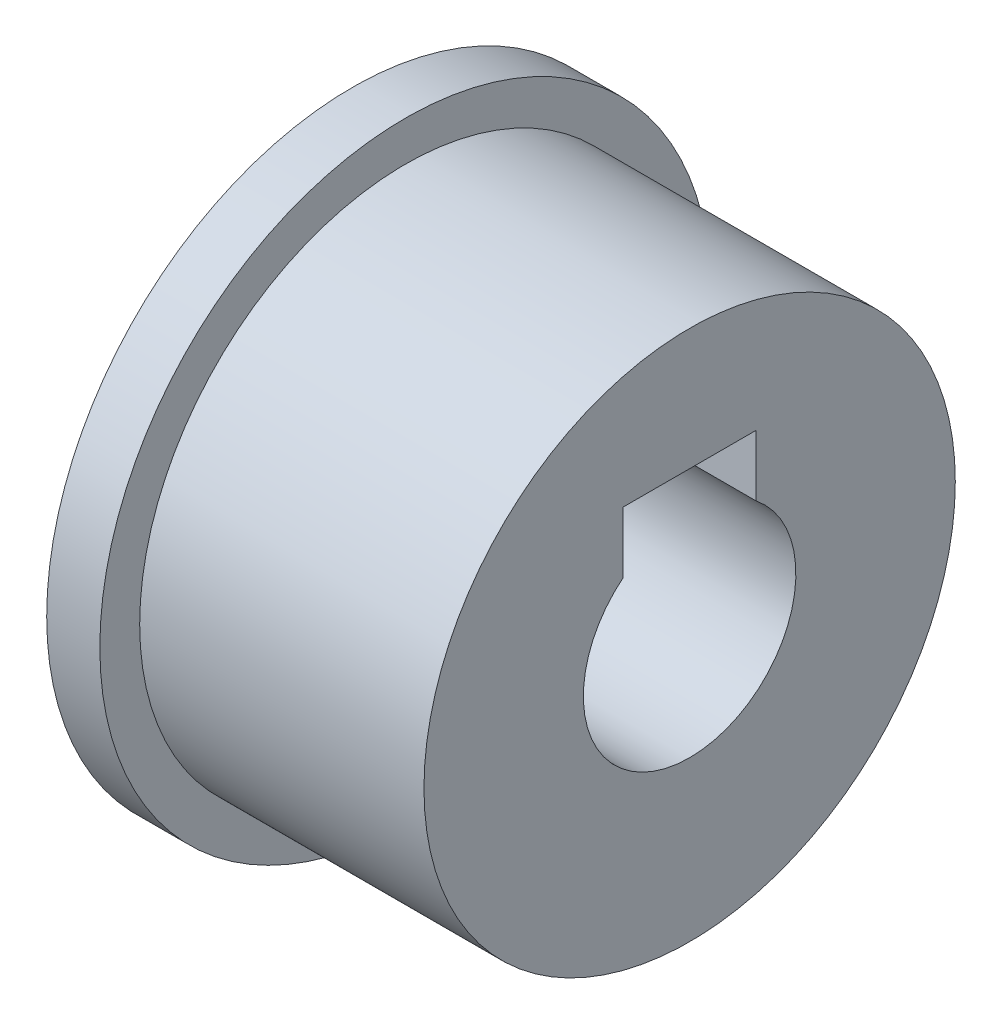
from build123d import *

# Parameters (mm, degrees)
SKETCH1_R           = 10
BOSS_EXTRUDE1_DEPTH = 12.7
SKETCH2_R           = 11.5
SKETCH2_R_2         = 10
BOSS_EXTRUDE2_DEPTH = 2


with BuildPart() as part:
    # Sketch1 → Boss-Extrude1 (new body)
    with BuildSketch(Plane(origin=(0, 0, 0), x_dir=(0, 0, -1), z_dir=(1, 0, 0))):
        Circle(SKETCH1_R)
        with BuildLine():
            Line((-2.5, 5.422498999), (2.5, 5.422498999))
            Line((2.5, 5.422498999), (2.5, 3.122498999))
            ThreePointArc((2.5, 3.122498999), (0, -4), (-2.5, 3.122498999))
            Line((-2.5, 3.122498999), (-2.5, 5.422498999))
        make_face(mode=Mode.SUBTRACT)
    extrude(amount=BOSS_EXTRUDE1_DEPTH)

    # Sketch2 → Boss-Extrude2 (add)
    with BuildSketch(Plane.ZY):
        Circle(SKETCH2_R)
        Circle(SKETCH2_R_2, mode=Mode.SUBTRACT)
    extrude(amount=-BOSS_EXTRUDE2_DEPTH)


solid = part.part
